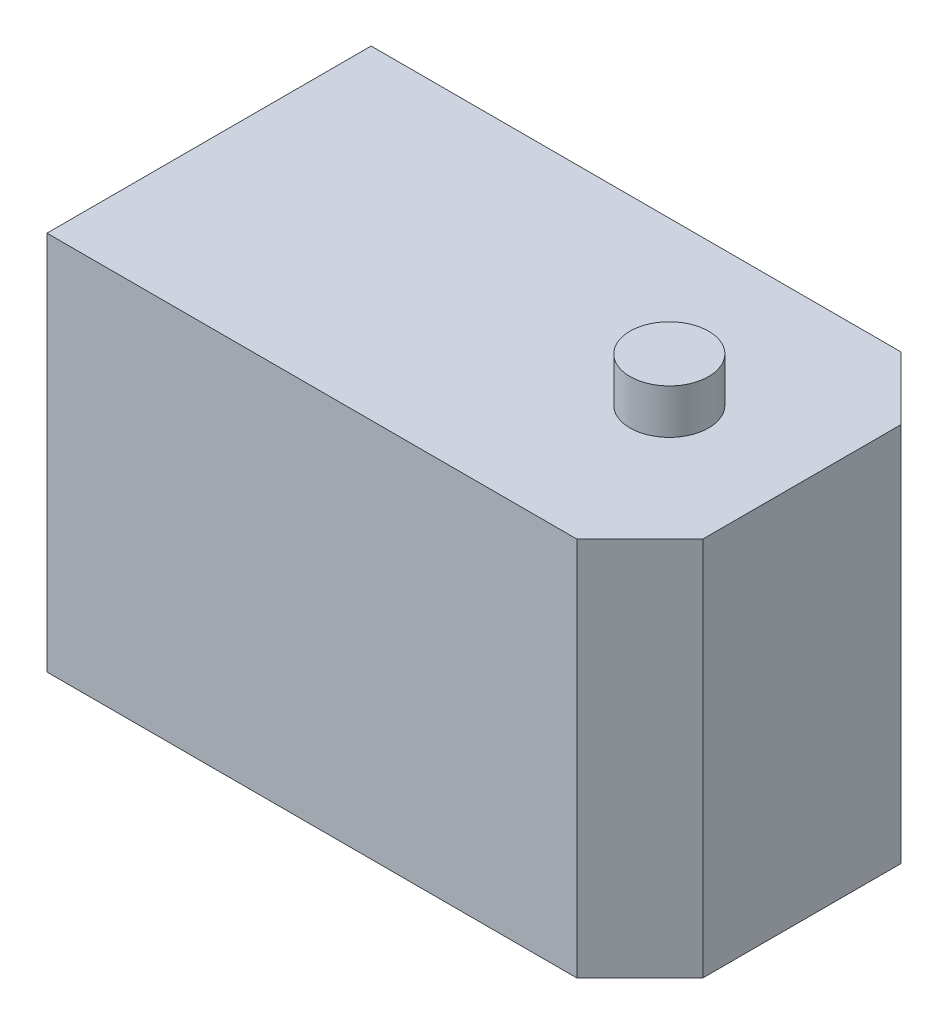
from build123d import *

# Parameters (mm, degrees)
SKETCH_1_W          = 45.23
SKETCH_1_H          = 24.73
EXTRUDE_1_DEPTH     = 29
SKETCH_2_R          = 3
EXTRUDE_2_DEPTH     = 3.4
EXTRUDE_START       = 4.1
SKETCH_3_R          = 3
EXTRUDE_3_DEPTH     = 4.1
CUT_EXTRUDE_1_DEPTH = 50.815323446


with BuildPart() as part:
    # ｽｹｯﾁ1 → ﾎﾞｽ - 押し出し1 (new body)
    with BuildSketch(Plane(origin=(0, 0, 0), x_dir=(1, 0, 0), z_dir=(0, 1, 0))):
        with Locations((-12.5, 0)):
            Rectangle(SKETCH_1_W, SKETCH_1_H)
    extrude(amount=EXTRUDE_1_DEPTH)

    # ｽｹｯﾁ2 → ﾎﾞｽ - 押し出し2 (add)
    with BuildSketch(Plane(origin=(0, 29, 0), x_dir=(1, 0, 0), z_dir=(0, 1, 0))):
        with Locations(Location((0, 0, 0), (0, 0, 270))):
            Circle(SKETCH_2_R)
    extrude(amount=EXTRUDE_2_DEPTH)

    # ｽｹｯﾁ3 → ﾎﾞｽ - 押し出し3 (add)
    with BuildSketch(Plane.XZ.offset(EXTRUDE_START)):
        with Locations(Location((0, 0, 0), (0, 0, 90))):
            Circle(SKETCH_3_R)
    extrude(amount=-EXTRUDE_3_DEPTH)

    # ｽｹｯﾁ4 → ｶｯﾄ - 押し出し1 (cut, through all)
    with BuildSketch(Plane(origin=(0, 29, 0), x_dir=(1, 0, 0), z_dir=(0, 1, 0))):
        Polygon((5.31266953, 12.365), (10.115, 12.365), (10.115, 7.56266953), align=None)
        Polygon((5.31266953, -12.365), (10.115, -12.365), (10.115, -7.56266953), align=None)
    extrude(amount=-CUT_EXTRUDE_1_DEPTH, mode=Mode.SUBTRACT)


solid = part.part
